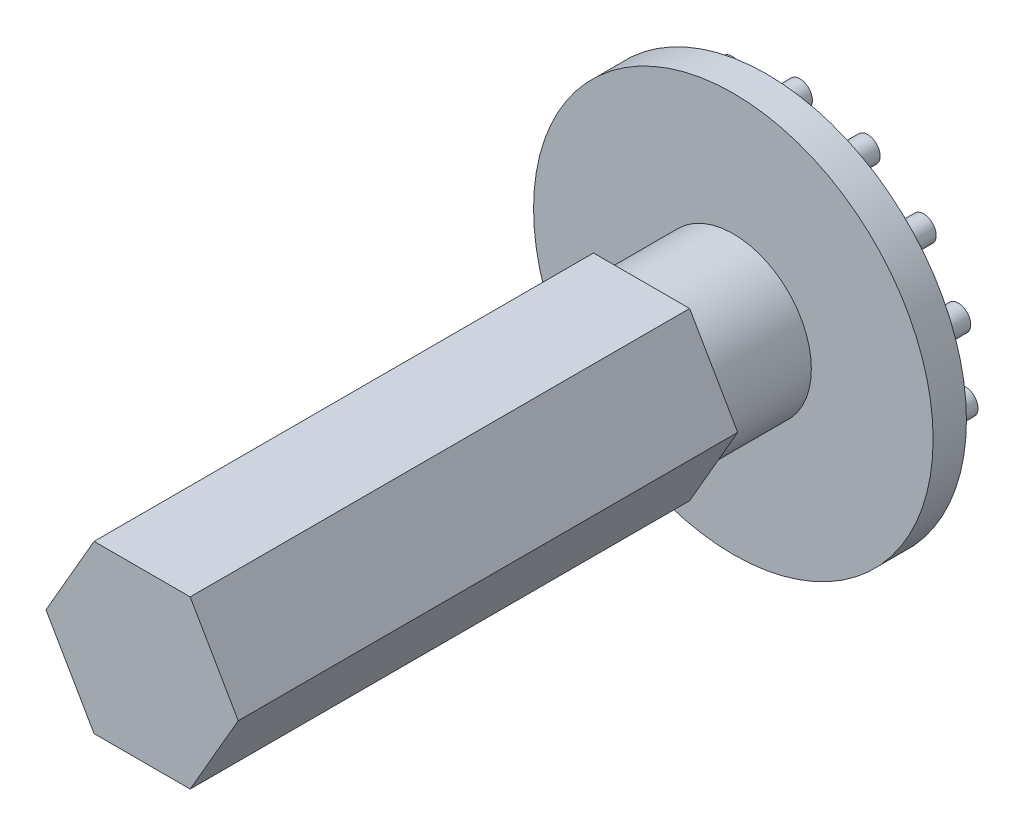
from build123d import *

# Parameters (mm, degrees)
SKETCH1_R           = 15.24
SKETCH1_R_2         = 4.55
BOSS_EXTRUDE1_DEPTH = 2.54
SKETCH2_R           = 5.95
BOSS_EXTRUDE2_DEPTH = 7
BOSS_EXTRUDE3_DEPTH = 38.1
SKETCH5_R           = 0.9525
BOSS_EXTRUDE5_DEPTH = 2.54


with BuildPart() as part:
    # Sketch1 → Boss-Extrude1 (new body)
    with BuildSketch(Plane.XY):
        Circle(SKETCH1_R)
        Circle(SKETCH1_R_2, mode=Mode.SUBTRACT)
    extrude(amount=BOSS_EXTRUDE1_DEPTH)

    # Sketch2 → Boss-Extrude2 (add)
    with BuildSketch(Plane.XY.offset(2.54)):
        Circle(SKETCH2_R)
    extrude(amount=BOSS_EXTRUDE2_DEPTH)

    # Sketch3 → Boss-Extrude3 (add)
    with BuildSketch(Plane.XY.offset(9.54)):
        Polygon((3.666174209, 6.35), (-3.666174209, 6.35), (-7.332348419, 0), (-3.666174209, -6.35), (3.666174209, -6.35), (7.332348419, 0), align=None)
    extrude(amount=BOSS_EXTRUDE3_DEPTH)

    # Sketch5 → Boss-Extrude5 (add)
    with BuildSketch(Plane(origin=(0, 0, 0), x_dir=(-1, 0, 0), z_dir=(0, 0, -1))):
        with Locations(Location((0, 12.7, 0), (0, 0, 180))):
            Circle(SKETCH5_R)
        with Locations(Location((5.165555367, 11.602027312, 0), (0, 0, 180))):
            Circle(SKETCH5_R)
        with Locations(Location((9.437939284, 8.497958701, 0), (0, 0, 180))):
            Circle(SKETCH5_R)
        with Locations(Location((12.078417757, 3.924515829, 0), (0, 0, 180))):
            Circle(SKETCH5_R)
        with Locations(Location((12.630428071, -1.327511483, 0), (0, 0, 180))):
            Circle(SKETCH5_R)
        with Locations(Location((10.998522628, -6.35, 0), (0, 0, 180))):
            Circle(SKETCH5_R)
        with Locations(Location((7.464872704, -10.274515829, 0), (0, 0, 180))):
            Circle(SKETCH5_R)
        with Locations(Location((2.640478473, -12.422474529, 0), (0, 0, 180))):
            Circle(SKETCH5_R)
        with Locations(Location((-2.640478473, -12.422474529, 0), (0, 0, 180))):
            Circle(SKETCH5_R)
        with Locations(Location((-7.464872704, -10.274515829, 0), (0, 0, 180))):
            Circle(SKETCH5_R)
        with Locations(Location((-10.998522628, -6.35, 0), (0, 0, 180))):
            Circle(SKETCH5_R)
        with Locations(Location((-12.630428071, -1.327511483, 0), (0, 0, 180))):
            Circle(SKETCH5_R)
        with Locations(Location((-12.078417757, 3.924515829, 0), (0, 0, 180))):
            Circle(SKETCH5_R)
        with Locations(Location((-9.437939284, 8.497958701, 0), (0, 0, 180))):
            Circle(SKETCH5_R)
        with Locations(Location((-5.165555367, 11.602027312, 0), (0, 0, 180))):
            Circle(SKETCH5_R)
    extrude(amount=BOSS_EXTRUDE5_DEPTH)


solid = part.part
